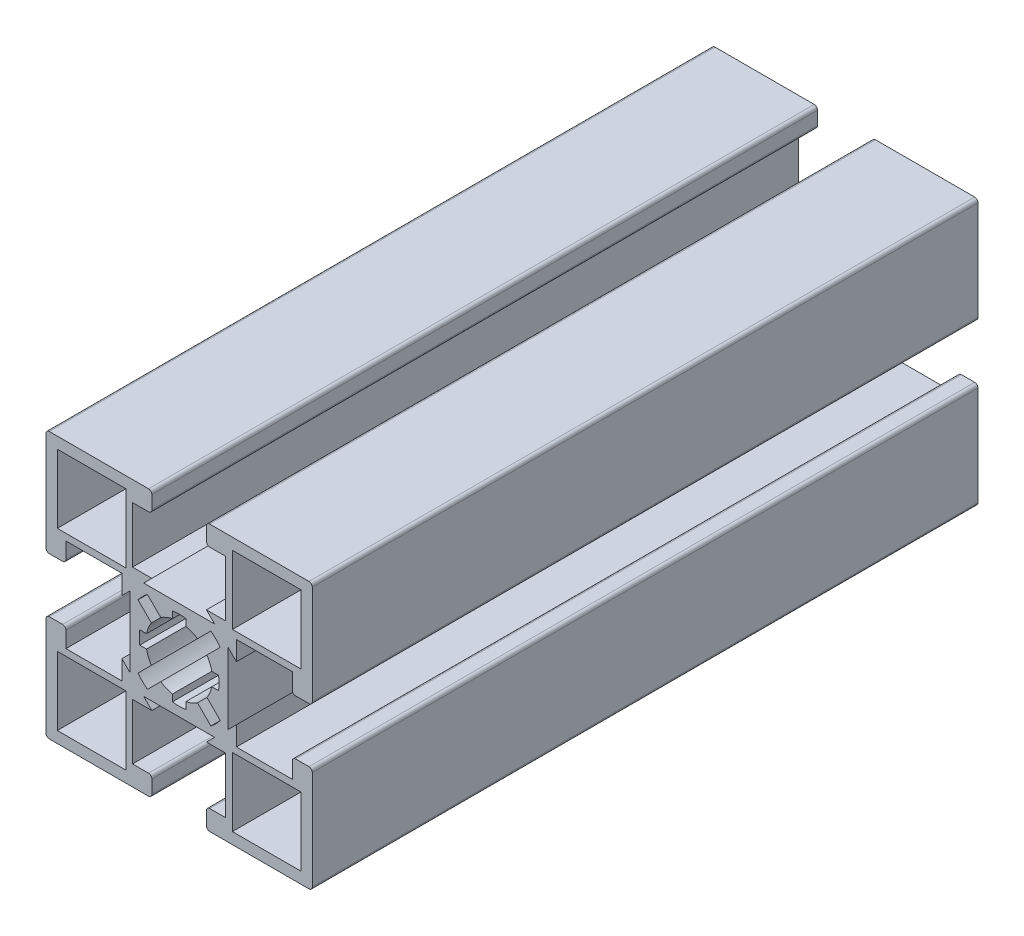
from build123d import *

# Parameters (mm, degrees)
SKETCH_1_W      = 10.3
SKETCH_1_H      = 10.3
EXTRUDE_1_DEPTH = 100


with BuildPart() as part:
    # 草图1 → 凸台-拉伸1 (new body)
    with BuildSketch(Plane.XY):
        with BuildLine():
            Line((-3.371587854, 9.357012623), (-6.271587854, 9.357012623))
            Line((-6.271587854, 9.357012623), (-6.271587854, 17.757012623))
            Line((-6.271587854, 17.757012623), (-3.871587854, 17.757012623))
            ThreePointArc((-3.871587854, 17.757012623), (-3.518034464, 17.903459232), (-3.371587854, 18.257012623))
            Line((-3.371587854, 18.257012623), (-3.371587854, 20.257012623))
            ThreePointArc((-3.371587854, 20.257012623), (-3.518034464, 20.610566013), (-3.871587854, 20.757012623))
            Line((-3.871587854, 20.757012623), (-18.771587854, 20.757012623))
            ThreePointArc((-18.771587854, 20.757012623), (-19.125141245, 20.610566013), (-19.271587854, 20.257012623))
            Line((-19.271587854, 20.257012623), (-19.271587854, 5.357012623))
            ThreePointArc((-19.271587854, 5.357012623), (-19.125141245, 5.003459232), (-18.771587854, 4.857012623))
            Line((-18.771587854, 4.857012623), (-16.771587854, 4.857012623))
            ThreePointArc((-16.771587854, 4.857012623), (-16.418034464, 5.003459232), (-16.271587854, 5.357012623))
            Line((-16.271587854, 5.357012623), (-16.271587854, 7.757012623))
            Line((-16.271587854, 7.757012623), (-7.871587854, 7.757012623))
            Line((-7.871587854, 7.757012623), (-7.871587854, 4.857012623))
            Line((-7.871587854, 4.857012623), (-6.641587854, 6.087012623))
            Line((-6.641587854, 6.087012623), (-6.641587854, -4.572987377))
            Line((-6.641587854, -4.572987377), (-7.871587854, -3.342987377))
            Line((-7.871587854, -3.342987377), (-7.871587854, -6.242987377))
            Line((-7.871587854, -6.242987377), (-16.271587854, -6.242987377))
            Line((-16.271587854, -6.242987377), (-16.271587854, -3.842987377))
            ThreePointArc((-16.271587854, -3.842987377), (-16.418034464, -3.489433987), (-16.771587854, -3.342987377))
            Line((-16.771587854, -3.342987377), (-18.771587854, -3.342987377))
            ThreePointArc((-18.771587854, -3.342987377), (-19.125141245, -3.489433987), (-19.271587854, -3.842987377))
            Line((-19.271587854, -3.842987377), (-19.271587854, -18.742987377))
            ThreePointArc((-19.271587854, -18.742987377), (-19.125141245, -19.096540768), (-18.771587854, -19.242987377))
            Line((-18.771587854, -19.242987377), (-3.871587854, -19.242987377))
            ThreePointArc((-3.871587854, -19.242987377), (-3.518034464, -19.096540768), (-3.371587854, -18.742987377))
            Line((-3.371587854, -18.742987377), (-3.371587854, -16.742987377))
            ThreePointArc((-3.371587854, -16.742987377), (-3.518034464, -16.389433987), (-3.871587854, -16.242987377))
            Line((-3.871587854, -16.242987377), (-6.271587854, -16.242987377))
            Line((-6.271587854, -16.242987377), (-6.271587854, -7.842987377))
            Line((-6.271587854, -7.842987377), (-3.371587854, -7.842987377))
            Line((-3.371587854, -7.842987377), (-4.601587854, -6.612987377))
            Line((-4.601587854, -6.612987377), (6.058412146, -6.612987377))
            Line((6.058412146, -6.612987377), (4.828412146, -7.842987377))
            Line((4.828412146, -7.842987377), (7.728412146, -7.842987377))
            Line((7.728412146, -7.842987377), (7.728412146, -16.242987377))
            Line((7.728412146, -16.242987377), (5.328412146, -16.242987377))
            ThreePointArc((5.328412146, -16.242987377), (4.974858755, -16.389433987), (4.828412146, -16.742987377))
            Line((4.828412146, -16.742987377), (4.828412146, -18.742987377))
            ThreePointArc((4.828412146, -18.742987377), (4.974858755, -19.096540768), (5.328412146, -19.242987377))
            Line((5.328412146, -19.242987377), (20.228412146, -19.242987377))
            ThreePointArc((20.228412146, -19.242987377), (20.581965536, -19.096540768), (20.728412146, -18.742987377))
            Line((20.728412146, -18.742987377), (20.728412146, -3.842987377))
            ThreePointArc((20.728412146, -3.842987377), (20.581965536, -3.489433987), (20.228412146, -3.342987377))
            Line((20.228412146, -3.342987377), (18.228412146, -3.342987377))
            ThreePointArc((18.228412146, -3.342987377), (17.874858755, -3.489433987), (17.728412146, -3.842987377))
            Line((17.728412146, -3.842987377), (17.728412146, -6.242987377))
            Line((17.728412146, -6.242987377), (9.328412146, -6.242987377))
            Line((9.328412146, -6.242987377), (9.328412146, -3.342987377))
            Line((9.328412146, -3.342987377), (8.098412146, -4.572987377))
            Line((8.098412146, -4.572987377), (8.098412146, 6.087012623))
            Line((8.098412146, 6.087012623), (9.328412146, 4.857012623))
            Line((9.328412146, 4.857012623), (9.328412146, 7.757012623))
            Line((9.328412146, 7.757012623), (17.728412146, 7.757012623))
            Line((17.728412146, 7.757012623), (17.728412146, 5.357012623))
            ThreePointArc((17.728412146, 5.357012623), (17.874858755, 5.003459232), (18.228412146, 4.857012623))
            Line((18.228412146, 4.857012623), (20.228412146, 4.857012623))
            ThreePointArc((20.228412146, 4.857012623), (20.581965536, 5.003459232), (20.728412146, 5.357012623))
            Line((20.728412146, 5.357012623), (20.728412146, 20.257012623))
            ThreePointArc((20.728412146, 20.257012623), (20.581965536, 20.610566013), (20.228412146, 20.757012623))
            Line((20.228412146, 20.757012623), (5.328412146, 20.757012623))
            ThreePointArc((5.328412146, 20.757012623), (4.974858755, 20.610566013), (4.828412146, 20.257012623))
            Line((4.828412146, 20.257012623), (4.828412146, 18.257012623))
            ThreePointArc((4.828412146, 18.257012623), (4.974858755, 17.903459232), (5.328412146, 17.757012623))
            Line((5.328412146, 17.757012623), (7.728412146, 17.757012623))
            Line((7.728412146, 17.757012623), (7.728412146, 9.357012623))
            Line((7.728412146, 9.357012623), (4.828412146, 9.357012623))
            Line((4.828412146, 9.357012623), (6.058412146, 8.127012623))
            Line((6.058412146, 8.127012623), (-4.601587854, 8.127012623))
            Line((-4.601587854, 8.127012623), (-3.371587854, 9.357012623))
        make_face()
        with Locations((-12.421587854, 13.907012623)):
            Rectangle(SKETCH_1_W, SKETCH_1_H, mode=Mode.SUBTRACT)
        with Locations((13.878412146, 13.907012623)):
            Rectangle(SKETCH_1_W, SKETCH_1_H, mode=Mode.SUBTRACT)
        with Locations((-12.421587854, -12.392987377)):
            Rectangle(SKETCH_1_W, SKETCH_1_H, mode=Mode.SUBTRACT)
        with Locations((13.878412146, -12.392987377)):
            Rectangle(SKETCH_1_W, SKETCH_1_H, mode=Mode.SUBTRACT)
        with BuildLine():
            Line((-5.448612368, 5.519823574), (-3.44279625, 3.514007457))
            ThreePointArc((-3.44279625, 3.514007457), (-3.890985517, 2.670429785), (-4.17056734, 1.757012623))
            Line((-4.17056734, 1.757012623), (-5.187667637, 1.757012623))
            ThreePointArc((-5.187667637, 1.757012623), (-5.271587854, 0.757012623), (-5.187667637, -0.242987377))
            Line((-5.187667637, -0.242987377), (-4.17056734, -0.242987377))
            ThreePointArc((-4.17056734, -0.242987377), (-3.890985517, -1.156404539), (-3.44279625, -1.999982211))
            Line((-3.44279625, -1.999982211), (-5.448612368, -4.005798329))
            ThreePointArc((-5.448612368, -4.005798329), (-4.787020747, -4.758420271), (-4.034398805, -5.420011891))
            Line((-4.034398805, -5.420011891), (-2.028582688, -3.414195774))
            ThreePointArc((-2.028582688, -3.414195774), (-1.185005016, -3.86238504), (-0.271587854, -4.141966863))
            Line((-0.271587854, -4.141966863), (-0.271587854, -5.15906716))
            ThreePointArc((-0.271587854, -5.15906716), (0.728412146, -5.242987377), (1.728412146, -5.15906716))
            Line((1.728412146, -5.15906716), (1.728412146, -4.141966863))
            ThreePointArc((1.728412146, -4.141966863), (2.641829308, -3.86238504), (3.48540698, -3.414195774))
            Line((3.48540698, -3.414195774), (5.491223097, -5.420011891))
            ThreePointArc((5.491223097, -5.420011891), (6.243845039, -4.758420271), (6.905436659, -4.005798329))
            Line((6.905436659, -4.005798329), (4.899620542, -1.999982211))
            ThreePointArc((4.899620542, -1.999982211), (5.347809808, -1.156404539), (5.627391631, -0.242987377))
            Line((5.627391631, -0.242987377), (6.644491929, -0.242987377))
            ThreePointArc((6.644491929, -0.242987377), (6.728412146, 0.757012623), (6.644491929, 1.757012623))
            Line((6.644491929, 1.757012623), (5.627391631, 1.757012623))
            ThreePointArc((5.627391631, 1.757012623), (5.347809808, 2.670429785), (4.899620542, 3.514007457))
            Line((4.899620542, 3.514007457), (6.905436659, 5.519823574))
            ThreePointArc((6.905436659, 5.519823574), (6.243845039, 6.272445516), (5.491223097, 6.934037136))
            Line((5.491223097, 6.934037136), (3.48540698, 4.928221019))
            ThreePointArc((3.48540698, 4.928221019), (2.641829308, 5.376410285), (1.728412146, 5.655992108))
            Line((1.728412146, 5.655992108), (1.728412146, 6.673092406))
            ThreePointArc((1.728412146, 6.673092406), (0.728412146, 6.757012623), (-0.271587854, 6.673092406))
            Line((-0.271587854, 6.673092406), (-0.271587854, 5.655992108))
            ThreePointArc((-0.271587854, 5.655992108), (-1.185005016, 5.376410285), (-2.028582688, 4.928221019))
            Line((-2.028582688, 4.928221019), (-4.034398805, 6.934037136))
            ThreePointArc((-4.034398805, 6.934037136), (-4.787020747, 6.272445516), (-5.448612368, 5.519823574))
        make_face(mode=Mode.SUBTRACT)
    extrude(amount=EXTRUDE_1_DEPTH)


solid = part.part
